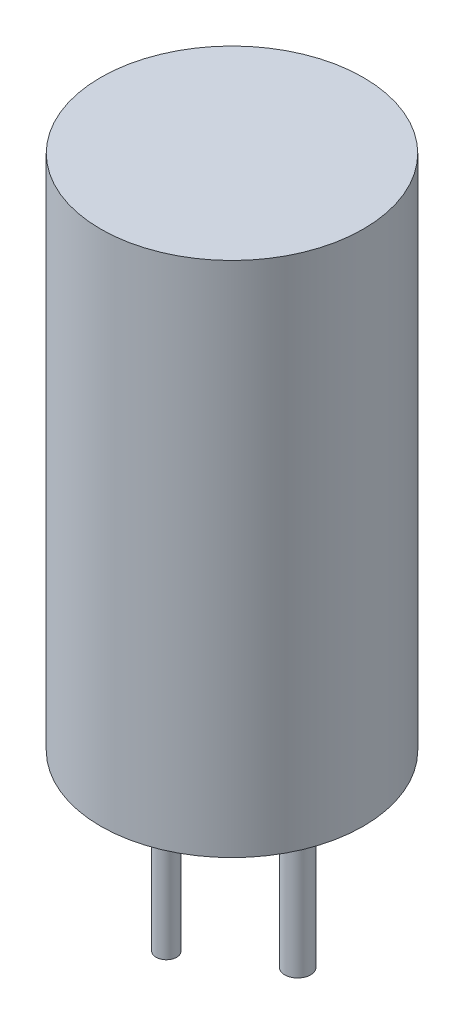
from build123d import *

# Parameters (mm, degrees)
SKETCH_1_R      = 5.08
EXTRUDE_1_DEPTH = 20
SKETCH_2_R      = 0.4
EXTRUDE_2_DEPTH = 8
SKETCH_3_R      = 0.5
EXTRUDE_3_DEPTH = 6


with BuildPart() as part:
    # 草图1 → 拉伸1 (new body)
    with BuildSketch(Plane(origin=(0, 0, 0), x_dir=(1, 0, 0), z_dir=(0, 1, 0))):
        with Locations(Location((0, 0, 0), (0, 0, 270))):
            Circle(SKETCH_1_R)
    extrude(amount=EXTRUDE_1_DEPTH)

    # 草图2 → 拉伸2 (add)
    with BuildSketch(Plane.XZ):
        with Locations(Location((-2.54, 0, 0), (0, 0, 90))):
            Circle(SKETCH_2_R)
    extrude(amount=EXTRUDE_2_DEPTH)

    # 草图3 → 拉伸3 (add)
    with BuildSketch(Plane.XZ):
        with Locations(Location((2.54, 0, 0), (0, 0, 90))):
            Circle(SKETCH_3_R)
    extrude(amount=EXTRUDE_3_DEPTH)


solid = part.part
